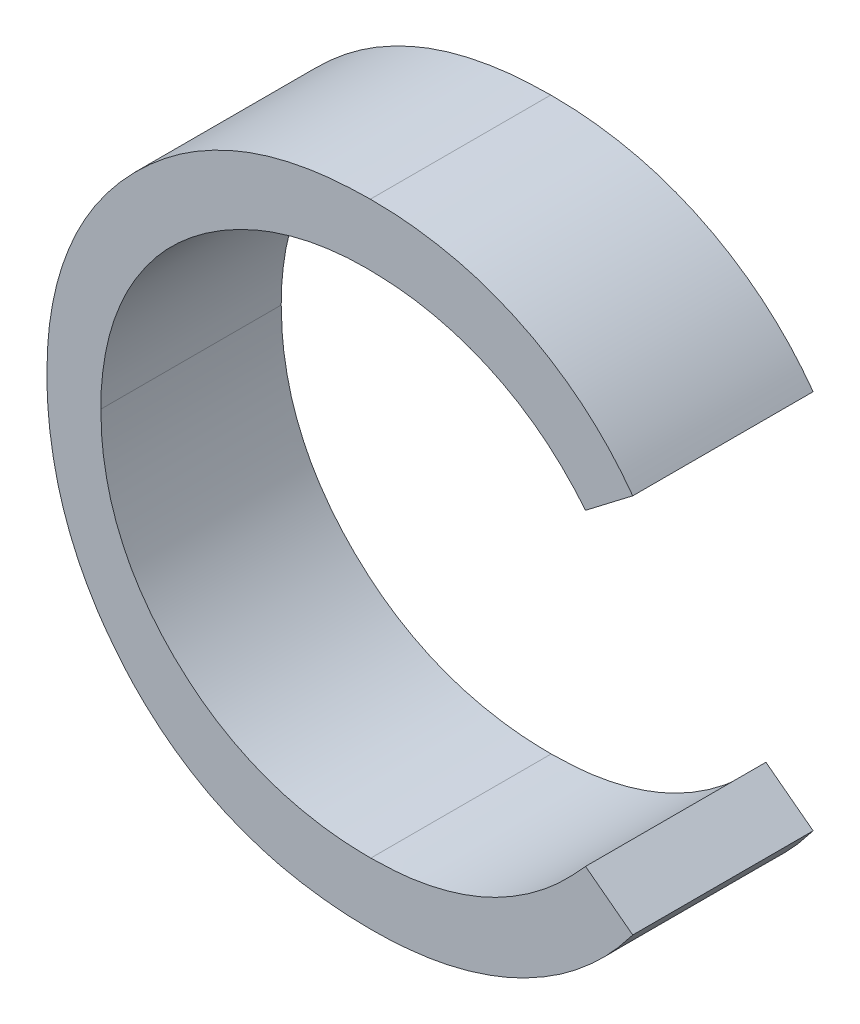
from build123d import *

# Parameters (mm, degrees)
BOSS_EXTRU_1_DEPTH = 1.5


with BuildPart() as part:
    # Esquisse1 → Boss.-Extru.1 (new body)
    with BuildSketch(Plane.XY):
        with BuildLine():
            Line((-50.81708071, -18.787587025), (-51.209708916, -19.088067794))
            add(Edge.make_bspline(
                [(-51.209708916, -19.088067794), (-51.237717328, -19.054687837), (-51.293356537, -18.988377958), (-51.382869684, -18.895264323), (-51.476157745, -18.808028235), (-51.573185061, -18.726254121), (-51.675698089, -18.652801599), (-51.781213516, -18.58384288), (-51.891496437, -18.522031826), (-52.043998915, -18.447084703), (-52.243495841, -18.36887591), (-52.494631326, -18.303299865), (-52.756790038, -18.261555329), (-52.935643752, -18.257034127), (-53.026615967, -18.254734461)],
                knots=[0, 0, 0, 0, 0.757959112, 1.505699292, 2.245454638, 2.979532153, 3.711538275, 4.438200793, 5.171680507, 5.909471876, 7.393775596, 8.890124382, 10.418191784, 12, 12, 12, 12], degree=3))
            add(Edge.make_bspline(
                [(-53.026615967, -18.254734461), (-53.076734966, -18.25531155), (-53.176507812, -18.256460373), (-53.32457706, -18.271616266), (-53.469881419, -18.292917995), (-53.612326371, -18.324525599), (-53.751730597, -18.364486484), (-53.889005457, -18.412237075), (-54.022163457, -18.471315418), (-54.153046655, -18.536612932), (-54.278445527, -18.610366424), (-54.397095596, -18.69081407), (-54.508564121, -18.777055636), (-54.612939281, -18.86941436), (-54.710327779, -18.967474303), (-54.800023937, -19.072280505), (-54.881717381, -19.183497896), (-54.957027416, -19.299659907), (-55.024474178, -19.420428181), (-55.080945435, -19.54624971), (-55.130952752, -19.674969857), (-55.170523099, -19.808042944), (-55.201843837, -19.944532609), (-55.223454785, -20.084805164), (-55.238438315, -20.228567563), (-55.239581425, -20.326009438), (-55.240157634, -20.375127089)],
                knots=[0, 0, 0, 0, 1.054917814, 2.100044995, 3.131103042, 4.146048494, 5.169673617, 6.183595914, 7.203665975, 8.234915748, 9.262203917, 10.264457458, 11.251630812, 12.227803204, 13.197192746, 14.159520551, 15.12972552, 16.100847026, 17.073214652, 18.039054194, 19.002613845, 19.979014051, 20.95965708, 21.949030935, 22.966165397, 24, 24, 24, 24], degree=3))
            add(Edge.make_bspline(
                [(-55.240157634, -20.375127089), (-55.238355035, -20.449028975), (-55.234815872, -20.594125524), (-55.203318252, -20.806654968), (-55.155453835, -21.010255931), (-55.083717297, -21.203655705), (-54.99526151, -21.389239074), (-54.883489208, -21.563866007), (-54.754037012, -21.730175385), (-54.605073556, -21.884236739), (-54.441636676, -22.024970633), (-54.266282516, -22.148900035), (-54.079447819, -22.25220701), (-53.883195491, -22.338172648), (-53.676015328, -22.404253687), (-53.458279896, -22.450773863), (-53.23046276, -22.481119836), (-53.074792189, -22.484025104), (-52.995566287, -22.485503692)],
                knots=[0, 0, 0, 0, 1.029171465, 2.020641659, 2.987623507, 3.938342917, 4.889210282, 5.84687017, 6.821220943, 7.821438502, 8.827599549, 9.822697543, 10.807740252, 11.797342354, 12.80366471, 13.83203677, 14.896651826, 16, 16, 16, 16], degree=3))
            add(Edge.make_bspline(
                [(-52.995566287, -22.485503692), (-52.908276732, -22.483091149), (-52.736470005, -22.478342688), (-52.484515681, -22.43811519), (-52.24332173, -22.372889593), (-52.012875178, -22.281606847), (-51.793825684, -22.16294215), (-51.585830455, -22.019088039), (-51.388713925, -21.848676135), (-51.270183522, -21.71855738), (-51.209708916, -21.652170358)],
                knots=[0, 0, 0, 0, 1.028121516, 2.023589091, 2.998037872, 3.967518031, 4.937445131, 5.927275754, 6.942489185, 8, 8, 8, 8], degree=3))
            Line((-51.209708916, -21.652170358), (-50.81708071, -21.94964632))
            add(Edge.make_bspline(
                [(-50.81708071, -21.94964632), (-50.84867801, -21.990415537), (-50.911721261, -22.071758689), (-51.013804142, -22.18643256), (-51.121343138, -22.294295468), (-51.23513701, -22.394477784), (-51.353876712, -22.488984163), (-51.479694301, -22.575129636), (-51.610935776, -22.654116614), (-51.74715646, -22.726440792), (-51.888211621, -22.790608287), (-52.033932243, -22.845542241), (-52.183690208, -22.892863512), (-52.337492363, -22.93179485), (-52.49565773, -22.962182113), (-52.65761555, -22.982495934), (-52.823715371, -22.996412955), (-52.935774544, -22.997681406), (-52.99256148, -22.998324204)],
                knots=[0, 0, 0, 0, 0.986787822, 1.968848986, 2.935600012, 3.899624008, 4.868462664, 5.837806735, 6.815139263, 7.798259679, 8.787526145, 9.778297419, 10.776456485, 11.791383307, 12.812564526, 13.85620153, 14.913611965, 16, 16, 16, 16], degree=3))
            add(Edge.make_bspline(
                [(-52.99256148, -22.998324204), (-53.046338147, -22.997949929), (-53.152674847, -22.997209847), (-53.309673064, -22.985221036), (-53.462515322, -22.968864269), (-53.610764787, -22.94423551), (-53.755230466, -22.915172168), (-53.89460273, -22.876213229), (-54.03025303, -22.832571563), (-54.161636374, -22.781278725), (-54.288864517, -22.723398464), (-54.411527104, -22.657981951), (-54.529567722, -22.585579287), (-54.644146895, -22.507786415), (-54.753572014, -22.422104556), (-54.858791336, -22.329723649), (-54.960394874, -22.230955062), (-55.023255852, -22.159733843), (-55.054861159, -22.123925166)],
                knots=[0, 0, 0, 0, 1.114604814, 2.203992996, 3.262667896, 4.300477797, 5.318619304, 6.316056647, 7.298880507, 8.271930387, 9.238335007, 10.195173496, 11.151986948, 12.108099108, 13.064862484, 14.031167946, 15.010108607, 16, 16, 16, 16], degree=3))
            add(Edge.make_bspline(
                [(-55.054861159, -22.123925166), (-55.105483507, -22.061723468), (-55.206117045, -21.938071024), (-55.334868022, -21.737662479), (-55.445078815, -21.528422181), (-55.534187273, -21.309250854), (-55.603848321, -21.080640301), (-55.652107171, -20.84247528), (-55.683466606, -20.59497822), (-55.687052733, -20.426639951), (-55.688875582, -20.341072602)],
                knots=[0, 0, 0, 0, 0.994628077, 1.977248131, 2.950237994, 3.925870899, 4.908910175, 5.911660606, 6.938484602, 8, 8, 8, 8], degree=3))
            add(Edge.make_bspline(
                [(-55.688875582, -20.341072602), (-55.686653877, -20.25113624), (-55.682282811, -20.074192062), (-55.64514596, -19.814514986), (-55.585404823, -19.565727273), (-55.500552125, -19.328293352), (-55.392973052, -19.10096438), (-55.260077889, -18.885476945), (-55.103410543, -18.680452945), (-54.924199732, -18.489003301), (-54.727674967, -18.313947083), (-54.517219519, -18.15993822), (-54.293245309, -18.03177034), (-54.058219807, -17.924632965), (-53.810383119, -17.842283732), (-53.55026402, -17.784636323), (-53.278351285, -17.748754728), (-53.092833534, -17.744218717), (-52.998571095, -17.741913948)],
                knots=[0, 0, 0, 0, 1.032925535, 2.032216505, 3.007276963, 3.968222605, 4.92396291, 5.891752235, 6.871517503, 7.883894988, 8.900124299, 9.891468569, 10.874487609, 11.85992873, 12.854644235, 13.869047385, 14.917252991, 16, 16, 16, 16], degree=3))
            add(Edge.make_bspline(
                [(-52.998571095, -17.741913948), (-52.941121849, -17.742602717), (-52.827406853, -17.743966065), (-52.659188778, -17.757260554), (-52.495414026, -17.779422849), (-52.335969766, -17.809588663), (-52.180080314, -17.847027693), (-52.028937113, -17.895799548), (-51.881653274, -17.951566022), (-51.739157691, -18.015792401), (-51.602134048, -18.087887746), (-51.470625022, -18.167052923), (-51.345675224, -18.253189788), (-51.22640544, -18.345565753), (-51.114810853, -18.446135123), (-51.007723026, -18.552131689), (-50.908778629, -18.66660858), (-50.847702636, -18.747187057), (-50.81708071, -18.787587025)],
                knots=[0, 0, 0, 0, 1.096760587, 2.17092713, 3.219439832, 4.250915756, 5.268269357, 6.278326846, 7.281116186, 8.274029601, 9.260640565, 10.235837813, 11.203064059, 12.156899882, 13.114053108, 14.069676657, 15.032185724, 16, 16, 16, 16], degree=3))
        make_face()
    extrude(amount=BOSS_EXTRU_1_DEPTH)


solid = part.part
